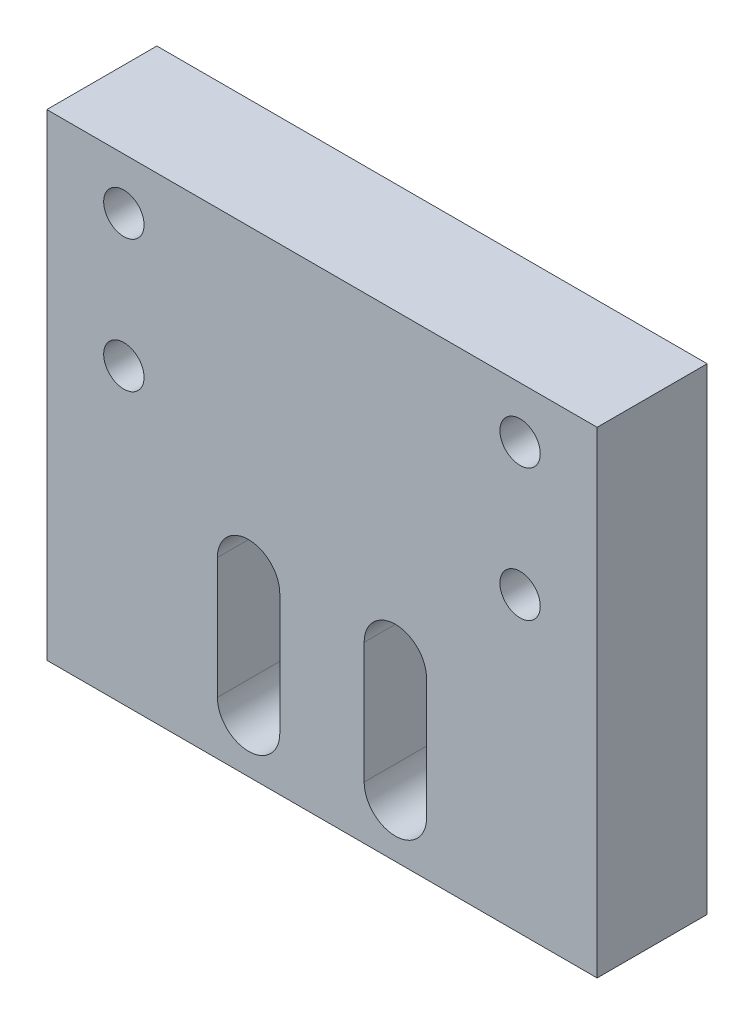
from build123d import *

# Parameters (mm, degrees)
SKETCH1_W           = 75
SKETCH1_H           = 65
SKETCH1_R           = 2.75
BOSS_EXTRUDE1_DEPTH = 15


with BuildPart() as part:
    # Sketch1 → Boss-Extrude1 (new body)
    with BuildSketch(Plane.XY):
        with Locations((0, 1.421243981)):
            Rectangle(SKETCH1_W, SKETCH1_H)
        with Locations((-27, 8.921243981)):
            Circle(SKETCH1_R, mode=Mode.SUBTRACT)
        with Locations((-27, 26.921243981)):
            Circle(SKETCH1_R, mode=Mode.SUBTRACT)
        with Locations((27, 26.921243981)):
            Circle(SKETCH1_R, mode=Mode.SUBTRACT)
        with Locations((27, 8.921243981)):
            Circle(SKETCH1_R, mode=Mode.SUBTRACT)
        with BuildLine():
            Line((-5.75, -7.328756019), (-5.75, -23.828756019))
            ThreePointArc((-5.75, -23.828756019), (-10, -28.078756019), (-14.25, -23.828756019))
            Line((-14.25, -23.828756019), (-14.25, -7.328756019))
            ThreePointArc((-14.25, -7.328756019), (-10, -3.078756019), (-5.75, -7.328756019))
        make_face(mode=Mode.SUBTRACT)
        with BuildLine():
            Line((14.25, -7.328756019), (14.25, -23.828756019))
            ThreePointArc((14.25, -23.828756019), (10, -28.078756019), (5.75, -23.828756019))
            Line((5.75, -23.828756019), (5.75, -7.328756019))
            ThreePointArc((5.75, -7.328756019), (10, -3.078756019), (14.25, -7.328756019))
        make_face(mode=Mode.SUBTRACT)
    extrude(amount=BOSS_EXTRUDE1_DEPTH)


solid = part.part
